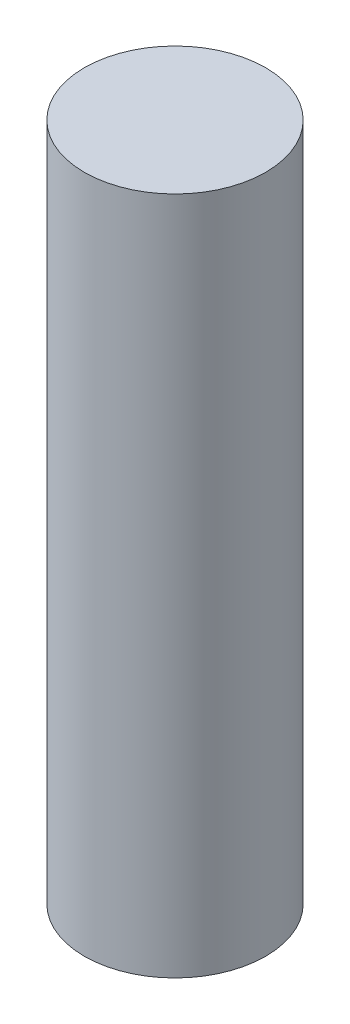
from build123d import *

# Parameters (mm, degrees)
SKETCH1_R           = 13.35
BOSS_EXTRUDE1_DEPTH = 100


with BuildPart() as part:
    # Sketch1 → Boss-Extrude1 (new body)
    with BuildSketch(Plane(origin=(0, 0, 0), x_dir=(1, 0, 0), z_dir=(0, 1, 0))):
        with Locations(Location((0, 0, 0), (0, 0, 270))):
            Circle(SKETCH1_R)
    extrude(amount=BOSS_EXTRUDE1_DEPTH)


solid = part.part
